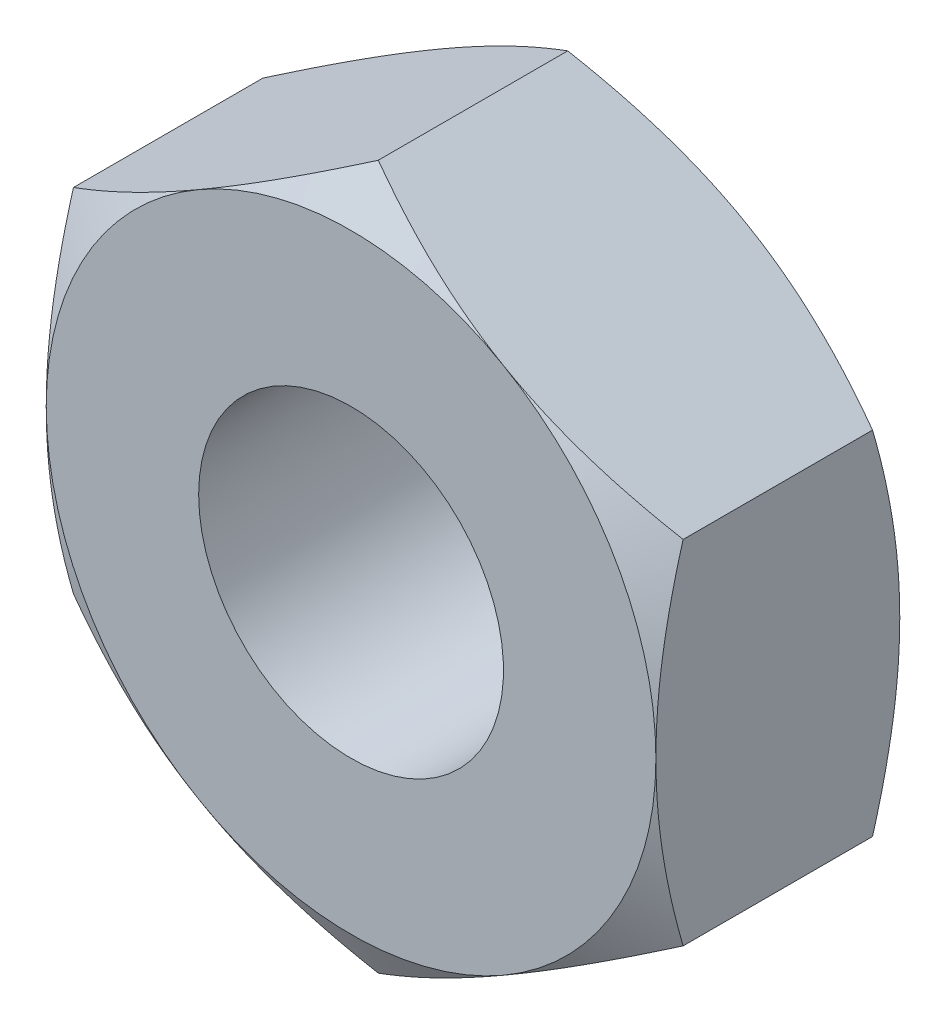
from build123d import *

# Parameters (mm, degrees)
EXTRUDE1_DEPTH          = 1
SKETCH13_R              = 1.25
BOSS_EXTRUDE1_DEPTH     = 2
SKETCH7_OUTSIDE_W       = 96.568
SKETCH7_OUTSIDE_H       = 97.342
SKETCH7_OUTSIDE_R       = 2.5
EXTRUDE2_DEPTH          = 25.4
EXTRUDE2_DRAFT          = -60
MIRROR2_COPY_1_SKETCH_W = 96.568
MIRROR2_COPY_1_SKETCH_H = 97.342
MIRROR2_COPY_1_SKETCH_R = 2.5
MIRROR2_COPY_1_DEPTH    = 25.4
MIRROR2_COPY_1_DRAFT    = -60


with BuildPart() as part:
    # Sketch1 → Extrude1 (new, symmetric)
    with BuildSketch(Plane.XY):
        Polygon((-2.5, 1.443375673), (-2.5, -1.443375673), (0, -2.886751346), (2.5, -1.443375673), (2.5, 1.443375673), (0, 2.886751346), align=None)
    extrude(amount=EXTRUDE1_DEPTH, both=True)

    # Cut-Extrude2 cone 1 section (through the dimple's axis) → Cut-Extrude2 (revolve, cut)
    with BuildSketch(Plane(origin=(0, 0, 1), x_dir=(0, -1, 0), z_dir=(1, 0, 0))):
        Polygon((0, 0), (1.25, 0), (0, 1.25), align=None)
    revolve(axis=Axis((0, 0, 1), (0, 0, -1)), mode=Mode.SUBTRACT)

    # Cut-Extrude3 cone 1 section (through the dimple's axis) → Cut-Extrude3 (revolve, cut)
    with BuildSketch(Plane(origin=(0, 0, -1), x_dir=(0, 1, 0), z_dir=(1, 0, 0))):
        Polygon((0, 0), (1.25, 0), (0, 1.25), align=None)
    revolve(axis=Axis((0, 0, -1), (0, 0, 1)), mode=Mode.SUBTRACT)


with BuildPart() as body_2:
    # Sketch13 → Boss-Extrude1 (new body)
    with BuildSketch(Plane(origin=(0, 0, -1), x_dir=(-1, 0, 0), z_dir=(0, 0, -1))):
        Circle(SKETCH13_R)
    extrude(amount=-BOSS_EXTRUDE1_DEPTH)


with BuildPart() as part_1:
    add(part.part)

    # Combine1: cut body 2
    add(body_2.part, mode=Mode.SUBTRACT)


with BuildPart() as extrude2_tool:
    # Sketch7 outside → Extrude2 (with draft: the straight prism first)
    with BuildSketch(Plane.XY.offset(1)):
        Rectangle(SKETCH7_OUTSIDE_W, SKETCH7_OUTSIDE_H)
        Circle(SKETCH7_OUTSIDE_R, mode=Mode.SUBTRACT)
    extrude(amount=-EXTRUDE2_DEPTH)
    # Extrude2: the draft: its side faces are tilted about the plane it starts from
    extrude2_sides = [extrude2_tool.faces().sort_by_distance(p)[0] for p in [
        (0, -48.671, -11.7),
        (48.284, 0, -11.7),
        (0, 48.671, -11.7),
        (-48.284, 0, -11.7),
        (-2.5, 0, -11.7),
    ]]
    draft(extrude2_sides, Plane.XY.offset(1), EXTRUDE2_DRAFT)


with BuildPart() as part_2:
    add(part_1.part)

    # Extrude2: cut by extrude2_tool
    add(extrude2_tool.part, mode=Mode.SUBTRACT)


with BuildPart() as mirror2_copy_1_tool:
    # Mirror2 copy 1 sketch → Mirror2 copy 1 (with draft: the straight prism first)
    with BuildSketch(Plane(origin=(0, 0, -1), x_dir=(1, 0, 0), z_dir=(0, 0, -1))):
        Rectangle(MIRROR2_COPY_1_SKETCH_W, MIRROR2_COPY_1_SKETCH_H)
        Circle(MIRROR2_COPY_1_SKETCH_R, mode=Mode.SUBTRACT)
    extrude(amount=-MIRROR2_COPY_1_DEPTH)
    # Mirror2 copy 1: the draft: its side faces are tilted about the plane it starts from
    mirror2_copy_1_sides = [mirror2_copy_1_tool.faces().sort_by_distance(p)[0] for p in [
        (0, -48.671, 11.7),
        (48.284, 0, 11.7),
        (0, 48.671, 11.7),
        (-48.284, 0, 11.7),
        (-2.5, 0, 11.7),
    ]]
    draft(mirror2_copy_1_sides, Plane(origin=(0, 0, -1), x_dir=(1, 0, 0), z_dir=(0, 0, -1)), MIRROR2_COPY_1_DRAFT)


with BuildPart() as part_3:
    add(part_2.part)

    # Mirror2 copy 1: cut by mirror2_copy_1_tool
    add(mirror2_copy_1_tool.part, mode=Mode.SUBTRACT)


solid = part_3.part
